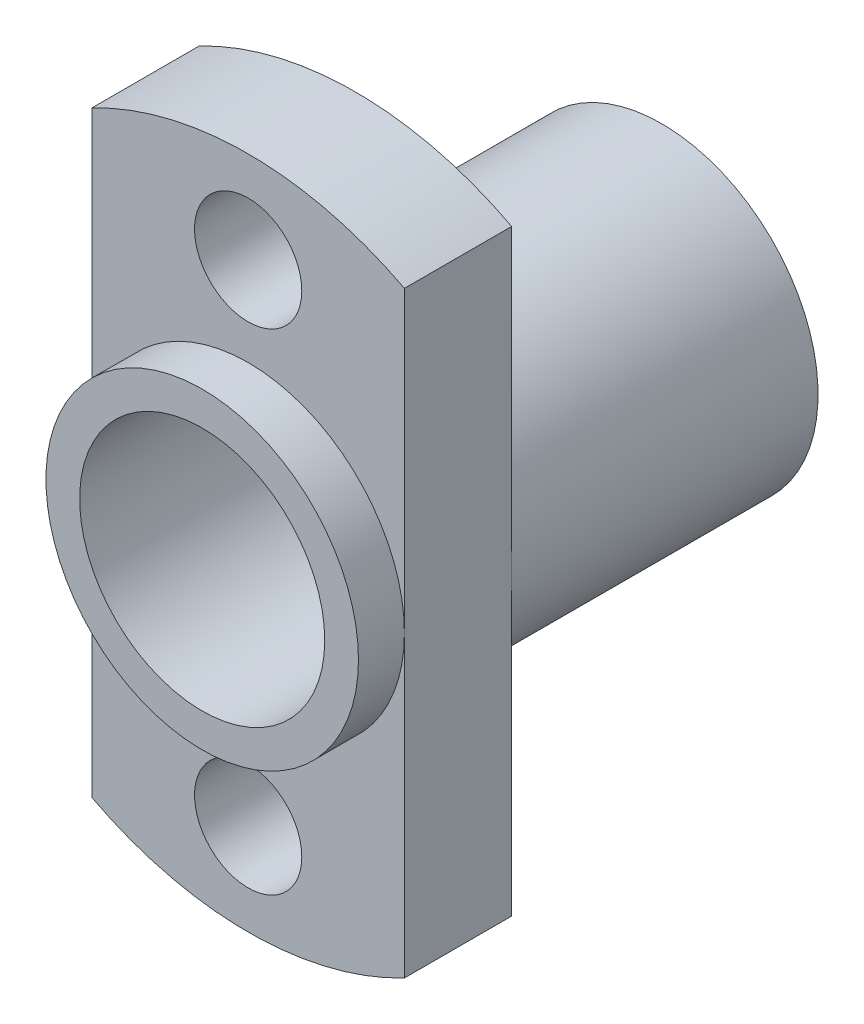
from build123d import *

# Parameters (mm, degrees)
SKETCH_1_R          = 11
EXTRUDE_1_DEPTH     = 3.5
CUT_EXTRUDE_1_REACH = 17.945
SKETCH_3_R          = 5.1
EXTRUDE_2_DEPTH     = 1.5
EXTRUDE_START       = 10
SKETCH_4_R          = 5.1
EXTRUDE_3_DEPTH     = 10
CUT_EXTRUDE_2_REACH = 20.146
SKETCH_5_R          = 1.75
CUT_EXTRUDE_3_REACH = 21.288
SKETCH_6_R          = 4


with BuildPart() as part:
    # 草图1 → 凸台-拉伸1 (new body)
    with BuildSketch(Plane.XY):
        Circle(SKETCH_1_R)
    extrude(amount=EXTRUDE_1_DEPTH)

    # 草图2 → 切除-拉伸1 (cut, up to next)
    with BuildSketch(Plane.XY.offset(3.5), mode=Mode.PRIVATE) as cut_extrude_1_sk1:
        with BuildLine():
            ThreePointArc((-5.1, 9.746281342), (-11, 0), (-5.1, -9.746281342))
            Line((-5.1, -9.746281342), (-5.1, 9.746281342))
        make_face()
    cut_extrude_1_tool1 = extrude(cut_extrude_1_sk1.sketch, amount=-CUT_EXTRUDE_1_REACH, mode=Mode.PRIVATE) & part.part
    # 草图2 → 切除-拉伸1 (cut, up to next)
    with BuildSketch(Plane.XY.offset(3.5), mode=Mode.PRIVATE) as cut_extrude_1_sk2:
        with BuildLine():
            Line((5.1, 9.746281342), (5.1, -9.746281342))
            ThreePointArc((5.1, -9.746281342), (9.410100956, -5.696490147), (11, 0))
            ThreePointArc((11, 0), (9.410100956, 5.696490147), (5.1, 9.746281342))
        make_face()
    cut_extrude_1_tool2 = extrude(cut_extrude_1_sk2.sketch, amount=-CUT_EXTRUDE_1_REACH, mode=Mode.PRIVATE) & part.part
    add(cut_extrude_1_tool1.solids().sort_by_distance((-7.524361, 0, 3.5))[0], mode=Mode.SUBTRACT)
    add(cut_extrude_1_tool2.solids().sort_by_distance((7.524361, 0, 3.5))[0], mode=Mode.SUBTRACT)

    # 草图3 → 凸台-拉伸2 (add)
    with BuildSketch(Plane.XY.offset(3.5)):
        Circle(SKETCH_3_R)
    extrude(amount=EXTRUDE_2_DEPTH)

    # 草图4 → 凸台-拉伸3 (add)
    with BuildSketch(Plane(origin=(0, 0, 0), x_dir=(-1, 0, 0), z_dir=(0, 0, -1)).offset(EXTRUDE_START)):
        with Locations(Location((0, 0, 0), (0, 0, 180))):
            Circle(SKETCH_4_R)
    extrude(amount=-EXTRUDE_3_DEPTH)

    # 草图5 → 切除-拉伸2 (cut, up to next)
    with BuildSketch(Plane.XY.offset(3.5), mode=Mode.PRIVATE) as cut_extrude_2_sk1:
        with Locations((0, 8)):
            Circle(SKETCH_5_R)
    cut_extrude_2_tool1 = extrude(cut_extrude_2_sk1.sketch, amount=-CUT_EXTRUDE_2_REACH, mode=Mode.PRIVATE) & part.part
    # 草图5 → 切除-拉伸2 (cut, up to next)
    with BuildSketch(Plane.XY.offset(3.5), mode=Mode.PRIVATE) as cut_extrude_2_sk2:
        with Locations((0, -8)):
            Circle(SKETCH_5_R)
    cut_extrude_2_tool2 = extrude(cut_extrude_2_sk2.sketch, amount=-CUT_EXTRUDE_2_REACH, mode=Mode.PRIVATE) & part.part
    add(cut_extrude_2_tool1.solids().sort_by_distance((0, 8, 3.5))[0], mode=Mode.SUBTRACT)
    add(cut_extrude_2_tool2.solids().sort_by_distance((0, -8, 3.5))[0], mode=Mode.SUBTRACT)

    # 草图6 → 切除-拉伸3 (cut, up to next)
    with BuildSketch(Plane.XY.offset(5), mode=Mode.PRIVATE) as cut_extrude_3_sk1:
        Circle(SKETCH_6_R)
    cut_extrude_3_tool1 = extrude(cut_extrude_3_sk1.sketch, amount=-CUT_EXTRUDE_3_REACH, mode=Mode.PRIVATE) & part.part
    add(cut_extrude_3_tool1.solids().sort_by_distance((0, 0, 5))[0], mode=Mode.SUBTRACT)


solid = part.part
